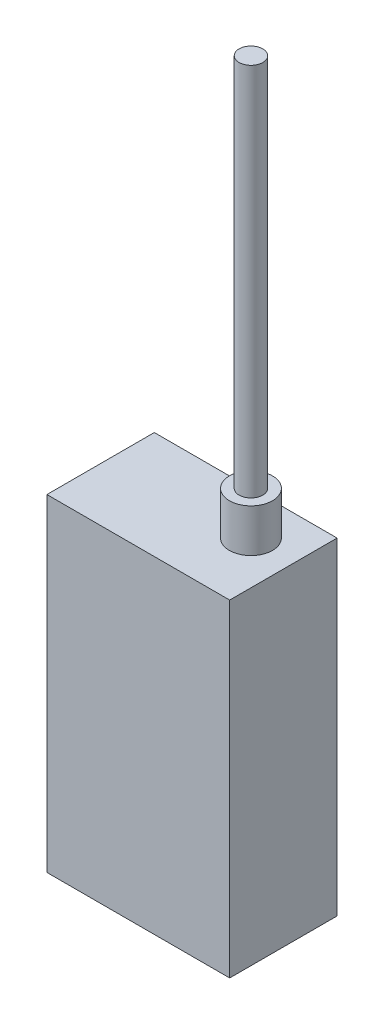
from build123d import *

# Parameters (mm, degrees)
SKETCH1_W           = 53.8988
SKETCH1_H           = 96.52
BOSS_EXTRUDE1_DEPTH = 31.6738
SKETCH2_R           = 6.35
BOSS_EXTRUDE2_DEPTH = 12.7
SKETCH3_R           = 3.4925
BOSS_EXTRUDE3_DEPTH = 110.49


with BuildPart() as part:
    # Sketch1 → Boss-Extrude1 (new body)
    with BuildSketch(Plane.XY):
        Rectangle(SKETCH1_W, SKETCH1_H)
    extrude(amount=BOSS_EXTRUDE1_DEPTH)

    # Sketch2 → Boss-Extrude2 (add)
    with BuildSketch(Plane(origin=(0, 48.26, 0), x_dir=(1, 0, 0), z_dir=(0, 1, 0))):
        with Locations(Location((14.2494, -12.7, 0), (0, 0, 90))):
            Circle(SKETCH2_R)
    extrude(amount=BOSS_EXTRUDE2_DEPTH)

    # Sketch3 → Boss-Extrude3 (add)
    with BuildSketch(Plane(origin=(0, 60.96, 0), x_dir=(1, 0, 0), z_dir=(0, 1, 0))):
        with Locations(Location((14.2494, -12.7, 0), (0, 0, 270))):
            Circle(SKETCH3_R)
    extrude(amount=BOSS_EXTRUDE3_DEPTH)


solid = part.part
